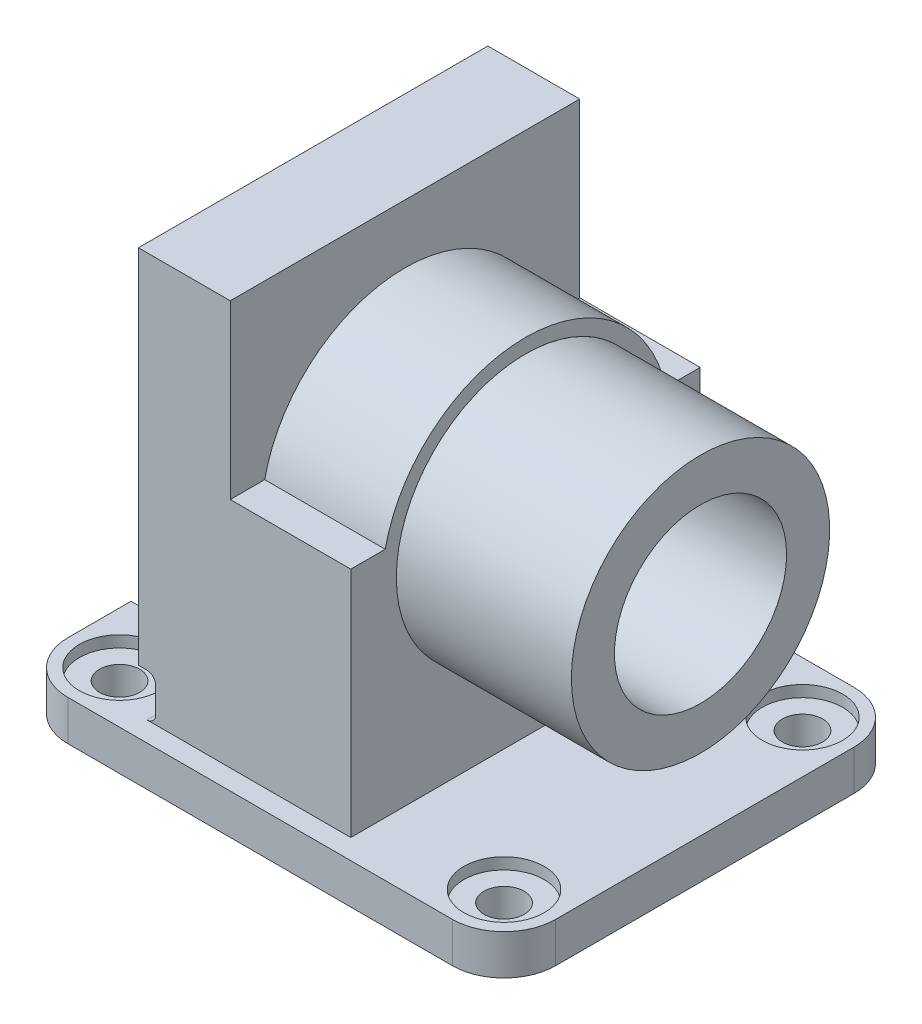
from build123d import *

# Parameters (mm, degrees)
SKETCH1_R            = 14
BOSS_EXTRUDE2_DEPTH  = 14
SKETCH5_W            = 32
SKETCH5_H            = 121.775184507
BOSS_EXTRUDE4_DEPTH  = 141
SKETCH7_W            = 42
SKETCH7_H            = 121.775184507
BOSS_EXTRUDE5_DEPTH  = 81
SKETCH8_R            = 45
CUT_EXTRUDE1_DEPTH   = 81
SKETCH9_R            = 50
CUT_EXTRUDE2_DEPTH   = 64
SKETCH10_R           = 50
SKETCH10_R_2         = 45
BOSS_EXTRUDE7_DEPTH  = 74
SKETCH12_R           = 45
BOSS_EXTRUDE8_DEPTH  = 61
SKETCH14_R           = 30
CUT_EXTRUDE3_DEPTH   = 108
CUT_EXTRUDE10_DEPTH  = 151
SKETCH21_R           = 4.25
CUT_EXTRUDE11_DEPTH  = 10
SKETCH22_R           = 14
SKETCH22_R_2         = 7
BOSS_EXTRUDE11_DEPTH = 10


with BuildPart() as part:
    # Sketch1 → Boss-Extrude2 (new body)
    with BuildSketch(Plane(origin=(0, 0, 0), x_dir=(1, 0, 0), z_dir=(0, 1, 0))):
        with BuildLine():
            ThreePointArc((152, 140), (164.727922061, 134.727922061), (170, 122))
            Line((170, 122), (170, 18))
            ThreePointArc((170, 18), (164.727922061, 5.272077939), (152, 0))
            Line((152, 0), (18, 0))
            ThreePointArc((18, 0), (5.272077939, 5.272077939), (0, 18))
            Line((0, 18), (0, 40))
            Line((0, 40), (30, 40))
            Line((30, 40), (30, 100))
            Line((30, 100), (0, 100))
            Line((0, 100), (0, 122))
            ThreePointArc((0, 122), (5.272077939, 134.727922061), (18, 140))
            Line((18, 140), (152, 140))
        make_face()
        with Locations(Location((18, 18, 0), (0, 0, 270))):
            Circle(SKETCH1_R, mode=Mode.SUBTRACT)
        with Locations(Location((152, 18, 0), (0, 0, 270))):
            Circle(SKETCH1_R, mode=Mode.SUBTRACT)
        with Locations(Location((152, 122, 0), (0, 0, 270))):
            Circle(SKETCH1_R, mode=Mode.SUBTRACT)
        with Locations(Location((18, 122, 0), (0, 0, 270))):
            Circle(SKETCH1_R, mode=Mode.SUBTRACT)
    extrude(amount=BOSS_EXTRUDE2_DEPTH)

    # Sketch5 → Boss-Extrude4 (add)
    with BuildSketch(Plane(origin=(0, 14, 0), x_dir=(1, 0, 0), z_dir=(0, 1, 0))):
        with Locations((51.595170786, 67.877136245)):
            Rectangle(SKETCH5_W, SKETCH5_H)
    extrude(amount=BOSS_EXTRUDE4_DEPTH)

    # Sketch7 → Boss-Extrude5 (add)
    with BuildSketch(Plane(origin=(0, 14, 0), x_dir=(1, 0, 0), z_dir=(0, 1, 0))):
        with Locations((88.595170786, 67.877136245)):
            Rectangle(SKETCH7_W, SKETCH7_H)
    extrude(amount=BOSS_EXTRUDE5_DEPTH)

    # Sketch8 → Cut-Extrude1 (cut)
    with BuildSketch(Plane.ZY.offset(-35.595170786)):
        with Locations((-67.877136245, 84.5)):
            Circle(SKETCH8_R)
    extrude(amount=-CUT_EXTRUDE1_DEPTH, mode=Mode.SUBTRACT)

    # Sketch9 → Cut-Extrude2 (cut)
    with BuildSketch(Plane.ZY.offset(-35.595170786)):
        with Locations((-67.877136245, 84.5)):
            Circle(SKETCH9_R)
    extrude(amount=-CUT_EXTRUDE2_DEPTH, mode=Mode.SUBTRACT)

    # Sketch10 → Boss-Extrude7 (add)
    with BuildSketch(Plane.ZY.offset(-35.595170786)):
        with Locations((-67.877136245, 84.5)):
            Circle(SKETCH10_R)
        with Locations((-67.877136245, 84.5)):
            Circle(SKETCH10_R_2, mode=Mode.SUBTRACT)
    extrude(amount=-BOSS_EXTRUDE7_DEPTH)

    # Sketch16 → Cut-Extrude10 (cut)
    with BuildSketch(Plane.XY.offset(-6.989543991)):
        with BuildLine():
            Line((41.595170786, 17), (41.595170786, 26))
            ThreePointArc((41.595170786, 26), (40.71649113, 28.121320344), (38.595170786, 29))
            Line((38.595170786, 29), (35.595170786, 29))
            Line((35.595170786, 29), (35.595170786, 14))
            Line((35.595170786, 14), (38.595170786, 14))
            ThreePointArc((38.595170786, 14), (40.71649113, 14.878679656), (41.595170786, 17))
        make_face()
    extrude(amount=-CUT_EXTRUDE10_DEPTH, mode=Mode.SUBTRACT)

    # Sketch21 → Cut-Extrude11 (cut)
    with BuildSketch(Plane.ZY.offset(-35.595170786)):
        with Locations((-112.877136245, 129.5)):
            Circle(SKETCH21_R)
        with Locations(Location((-112.877136245, 39.5, 0), (0, 0, 180))):
            Circle(SKETCH21_R)
        with Locations((-22.877136245, 38.645340566)):
            Circle(SKETCH21_R)
        with Locations(Location((-22.877136245, 129.5, 0), (0, 0, 180))):
            Circle(SKETCH21_R)
    extrude(amount=-CUT_EXTRUDE11_DEPTH, mode=Mode.SUBTRACT)

    # Sketch22 → Boss-Extrude11 (add)
    # profile 1 of 4: a face of its own
    with BuildSketch(Plane.XZ):
        with Locations(Location((18, -18, 0), (0, 0, 270))):
            Circle(SKETCH22_R)
        with Locations(Location((18, -18, 0), (0, 0, 270))):
            Circle(SKETCH22_R_2, mode=Mode.SUBTRACT)
    # profile 2 of 4: a face of its own
    with BuildSketch(Plane.XZ):
        with Locations(Location((152, -18, 0), (0, 0, 270))):
            Circle(SKETCH22_R)
        with Locations(Location((152, -18, 0), (0, 0, 270))):
            Circle(SKETCH22_R_2, mode=Mode.SUBTRACT)
    # profile 3 of 4: a face of its own
    with BuildSketch(Plane.XZ):
        with Locations(Location((18, -122, 0), (0, 0, 270))):
            Circle(SKETCH22_R)
        with Locations(Location((18, -122, 0), (0, 0, 270))):
            Circle(SKETCH22_R_2, mode=Mode.SUBTRACT)
    # profile 4 of 4: a face of its own
    with BuildSketch(Plane.XZ):
        with Locations(Location((152, -122, 0), (0, 0, 270))):
            Circle(SKETCH22_R)
        with Locations(Location((152, -122, 0), (0, 0, 270))):
            Circle(SKETCH22_R_2, mode=Mode.SUBTRACT)
    extrude(amount=-BOSS_EXTRUDE11_DEPTH)


with BuildPart() as body_2:
    # Sketch12 → Boss-Extrude8 (new body)
    with BuildSketch(Plane(origin=(109.595170786, 0, 0), x_dir=(0, 0, -1), z_dir=(1, 0, 0))):
        with Locations(Location((67.877136245, 84.5, 0), (0, 0, 180))):
            Circle(SKETCH12_R)
    extrude(amount=BOSS_EXTRUDE8_DEPTH)

    # Sketch14 → Cut-Extrude3 (cut)
    with BuildSketch(Plane(origin=(170.595170786, 0, 0), x_dir=(0, 0, -1), z_dir=(1, 0, 0))):
        with Locations((67.877136245, 84.5)):
            Circle(SKETCH14_R)
    extrude(amount=-CUT_EXTRUDE3_DEPTH, mode=Mode.SUBTRACT)


solid = Compound([part.part, body_2.part])
